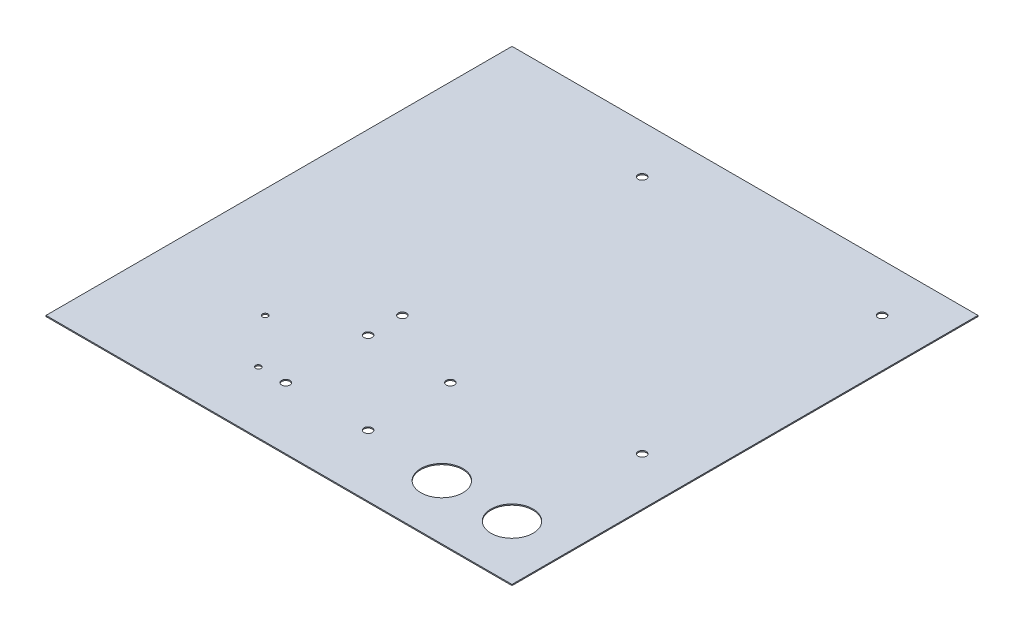
from build123d import *

# Parameters (mm, degrees)
BOSS_EXTRUDE1_DEPTH      = 86.36
BOSS_EXTRUDE1_DEPTH_BACK = 86.36
SKETCH3_W                = 172.72
SKETCH3_H                = 0.4064
SKETCH4_R                = 7.800000021
CUT_EXTRUDE1_DEPTH       = 123.132159405
SKETCH6_R                = 1.524
SKETCH6_R_2              = 1
CUT_EXTRUDE2_DEPTH       = 123.132159405


with BuildPart() as part:
    # Sketch3 → Boss-Extrude1 (new, two sides: drawn at the far end of the back side and taken through both)
    with BuildSketch(Plane.XY.offset(-BOSS_EXTRUDE1_DEPTH_BACK)):
        Rectangle(SKETCH3_W, SKETCH3_H)
    extrude(amount=BOSS_EXTRUDE1_DEPTH + BOSS_EXTRUDE1_DEPTH_BACK)

    # Sketch4 → Cut-Extrude1 (cut, through all)
    with BuildSketch(Plane(origin=(0, 0.2032, 0), x_dir=(1, 0, 0), z_dir=(0, 1, 0))):
        with Locations(Location((40.04, -66.04, 0), (0, 0, 270))):
            Circle(SKETCH4_R)
        with Locations(Location((66.04, -66.04, 0), (0, 0, 270))):
            Circle(SKETCH4_R)
    extrude(amount=-CUT_EXTRUDE1_DEPTH, mode=Mode.SUBTRACT)

    # Sketch6 → Cut-Extrude2 (cut, through all)
    with BuildSketch(Plane.XZ.offset(0.2032)):
        with Locations(Location((-20.32, 20.32, 0), (0, 0, 270))):
            Circle(SKETCH6_R)
        with Locations(Location((68.58, 20.32, 0), (0, 0, 270))):
            Circle(SKETCH6_R)
        with Locations(Location((68.58, -68.58, 0), (0, 0, 270))):
            Circle(SKETCH6_R)
        with Locations(Location((-20.32, -68.58, 0), (0, 0, 270))):
            Circle(SKETCH6_R)
        with Locations(Location((-20.32, 33.02, 0), (0, 0, 270))):
            Circle(SKETCH6_R)
        with Locations(Location((-20.32, 63.52032, 0), (0, 0, 270))):
            Circle(SKETCH6_R)
        with Locations(Location((10.18032, 63.52032, 0), (0, 0, 270))):
            Circle(SKETCH6_R)
        with Locations(Location((10.18032, 33.02, 0), (0, 0, 270))):
            Circle(SKETCH6_R)
        with Locations(Location((-45.72, 45.74032153, 0), (0, 0, 270))):
            Circle(SKETCH6_R_2)
        with Locations(Location((-30.48, 63.52032, 0), (0, 0, 270))):
            Circle(SKETCH6_R_2)
    extrude(amount=-CUT_EXTRUDE2_DEPTH, mode=Mode.SUBTRACT)


solid = part.part
